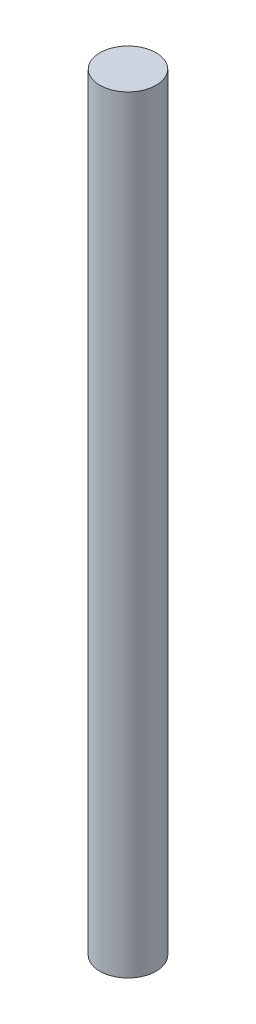
from build123d import *

# Parameters (mm, degrees)
SKETCH1_R           = 11
BOSS_EXTRUDE1_DEPTH = 300


with BuildPart() as part:
    # Sketch1 → Boss-Extrude1 (new body)
    with BuildSketch(Plane(origin=(0, 0, 0), x_dir=(1, 0, 0), z_dir=(0, 1, 0))):
        with Locations(Location((0, 0, 0), (0, 0, 270))):
            Circle(SKETCH1_R)
    extrude(amount=BOSS_EXTRUDE1_DEPTH)


solid = part.part
